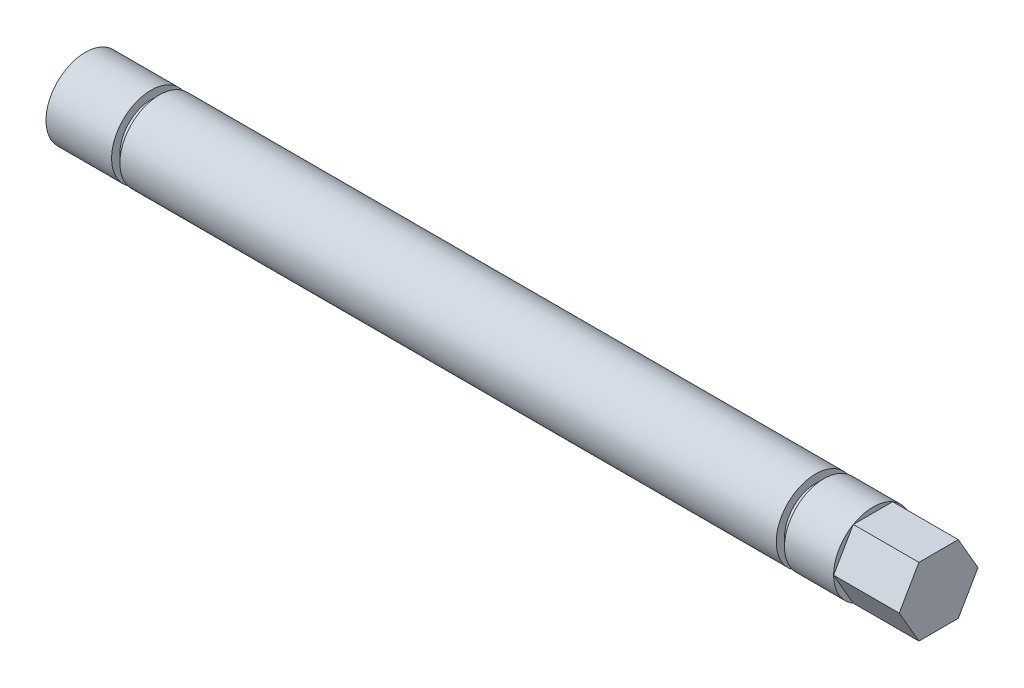
from build123d import *

# Parameters (mm, degrees)
BASE_SKETCH_R              = 7.62
BASE_EXTRUDE_DEPTH         = 165.1
END_CUT_SKETCH_W           = 1.6002
END_CUT_SKETCH_H           = 3.2004
GROOVE_SKETCH_R            = 7.62
GROOVE_SKETCH_R_2          = 6.0198
OFFSET_GROOVE_DEPTH        = 1.6002
HEXAGONAL_SKETCH_OUTSIDE_W = 50.54
HEXAGONAL_SKETCH_OUTSIDE_H = 50.54
HEXGONAL_CUT_DEPTH         = 12.7


with BuildPart() as part:
    # Base Sketch → Base Extrude (new body)
    with BuildSketch(Plane(origin=(0, 0, 0), x_dir=(0, 0, -1), z_dir=(1, 0, 0))):
        Circle(BASE_SKETCH_R)
    extrude(amount=BASE_EXTRUDE_DEPTH)

    # End Cut Sketch → End Cut Revolve (revolve, cut)
    with BuildSketch(Plane.XY, mode=Mode.PRIVATE) as end_cut_revolve_sk:
        with Locations((13.5001, 7.62)):
            Rectangle(END_CUT_SKETCH_W, END_CUT_SKETCH_H)
    revolve(end_cut_revolve_sk.sketch.rotate(Axis((0, 0, 0), (1, 0, 0)), 180), axis=Axis((0, 0, 0), (1, 0, 0)), mode=Mode.SUBTRACT)

    # Groove Sketch → Offset Groove (cut)
    with BuildSketch(Plane.ZY.offset(-141.3002)):
        with Locations(Location((0, 0, 0), (0, 0, 90))):
            Circle(GROOVE_SKETCH_R)
        with Locations(Location((0, 0, 0), (0, 0, 270))):
            Circle(GROOVE_SKETCH_R_2, mode=Mode.SUBTRACT)
    extrude(amount=-OFFSET_GROOVE_DEPTH, mode=Mode.SUBTRACT)

    # Hexagonal Sketch outside → Hexgonal Cut (cut)
    with BuildSketch(Plane(origin=(165.1, 0, 0), x_dir=(0, 0, -1), z_dir=(1, 0, 0))):
        Rectangle(HEXAGONAL_SKETCH_OUTSIDE_W, HEXAGONAL_SKETCH_OUTSIDE_H)
        Polygon((-3.81, 6.599113577), (-7.62, 0), (-3.81, -6.599113577), (3.81, -6.599113577), (7.62, 0), (3.81, 6.599113577), align=None, mode=Mode.SUBTRACT)
    extrude(amount=-HEXGONAL_CUT_DEPTH, mode=Mode.SUBTRACT)


solid = part.part
